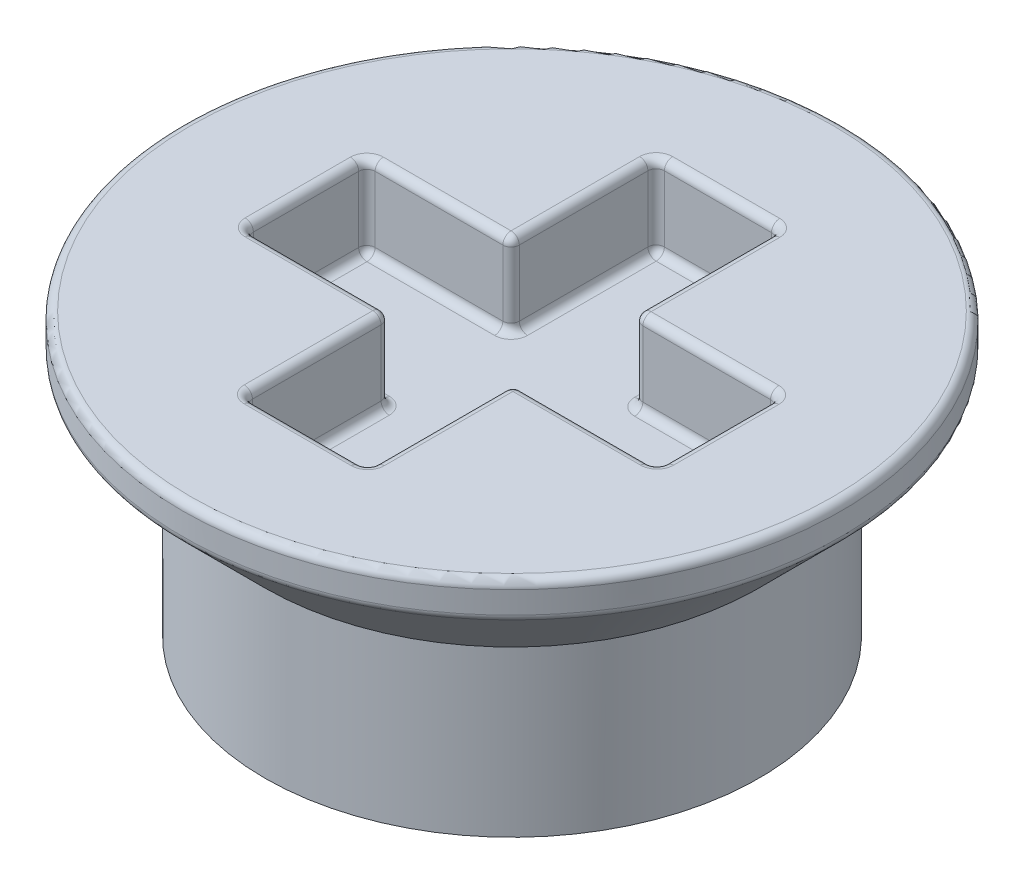
from build123d import *

# Parameters (mm, degrees)
SKETCH1_R           = 4
BOSS_EXTRUDE1_DEPTH = 1.41
CHAMFER2_SIZE       = 1
SKETCH2_R           = 3
BOSS_EXTRUDE2_DEPTH = 2
SKETCH4_W           = 1.5
SKETCH4_H           = 1.761062171
SKETCH4_H_2         = 1.477875658
SKETCH4_W_2         = 1.75
CUT_EXTRUDE1_DEPTH  = 1
FILLET2_R           = 0.1
FILLET3_R           = 0.1


with BuildPart() as part:
    # Sketch1 → Boss-Extrude1 (new body)
    with BuildSketch(Plane(origin=(0, 0, 0), x_dir=(1, 0, 0), z_dir=(0, 1, 0))):
        with Locations(Location((0, 0, 0), (0, 0, 270))):
            Circle(SKETCH1_R)
    extrude(amount=BOSS_EXTRUDE1_DEPTH)

    # Chamfer2
    chamfer2_edges = [part.edges().sort_by_distance(p)[0] for p in [
        (0, 0, -4),
    ]]
    chamfer(chamfer2_edges, length=CHAMFER2_SIZE)

    # Sketch2 → Boss-Extrude2 (add)
    with BuildSketch(Plane.XZ):
        with Locations(Location((0, 0, 0), (0, 0, 90))):
            Circle(SKETCH2_R)
    extrude(amount=BOSS_EXTRUDE2_DEPTH)

    # Sketch4 → Cut-Extrude1 (cut)
    with BuildSketch(Plane(origin=(0, 1.41, 0), x_dir=(1, 0, 0), z_dir=(0, 1, 0))):
        with Locations((0, 1.619468915)):
            Rectangle(SKETCH4_W, SKETCH4_H)
        Rectangle(SKETCH4_W, SKETCH4_H_2)
        with Locations((0, -1.619468915)):
            Rectangle(SKETCH4_W, SKETCH4_H)
        with Locations((-1.625, 0)):
            Rectangle(SKETCH4_W_2, SKETCH4_H_2)
        with Locations((1.625, 0)):
            Rectangle(SKETCH4_W_2, SKETCH4_H_2)
    extrude(amount=-CUT_EXTRUDE1_DEPTH, mode=Mode.SUBTRACT)

    # Fillet2
    fillet2_edges = [part.edges().sort_by_distance(p)[0] for p in [
        (-0.75, 1.41, -1.619468914),
        (-0.75, 0.91, -0.738937829),
        (0, 1.41, -2.5),
        (-0.75, 0.91, -2.5),
        (0.75, 0.41, -1.619468914),
        (0.75, 0.91, -2.5),
        (1.625, 1.41, -0.738937829),
        (0.75, 0.91, -0.738937829),
        (2.5, 0.41, 0),
        (2.5, 0.91, -0.738937829),
        (1.625, 0.41, 0.738937829),
        (2.5, 0.91, 0.738937829),
        (0.75, 0.41, 1.619468914),
        (0.75, 0.91, 0.738937829),
        (0, 0.41, 2.5),
        (0.75, 0.91, 2.5),
        (-0.75, 1.41, 1.619468914),
        (-0.75, 0.91, 2.5),
        (-1.625, 0.41, 0.738937829),
        (-0.75, 0.91, 0.738937829),
        (-2.5, 1.41, 0),
        (-2.5, 0.91, 0.738937829),
        (-1.625, 1.41, -0.738937829),
        (-2.5, 0.91, -0.738937829),
        (-0.75, 0.41, -1.619468914),
        (0, 0.41, -2.5),
        (1.625, 0.41, -0.738937829),
        (-0.75, 0.41, 1.619468914),
        (-2.5, 0.41, 0),
        (-1.625, 0.41, -0.738937829),
        (-1.625, 1.41, 0.738937829),
        (0, 1.41, 2.5),
        (0.75, 1.41, 1.619468914),
        (1.625, 1.41, 0.738937829),
        (2.5, 1.41, 0),
        (0.75, 1.41, -1.619468914),
        (0, 1.41, -4),
    ]]
    fillet(fillet2_edges, radius=FILLET2_R)

    # Fillet3
    fillet3_edges = [part.edges().sort_by_distance(p)[0] for p in [
        (0, 1, -4),
    ]]
    fillet(fillet3_edges, radius=FILLET3_R)


solid = part.part
